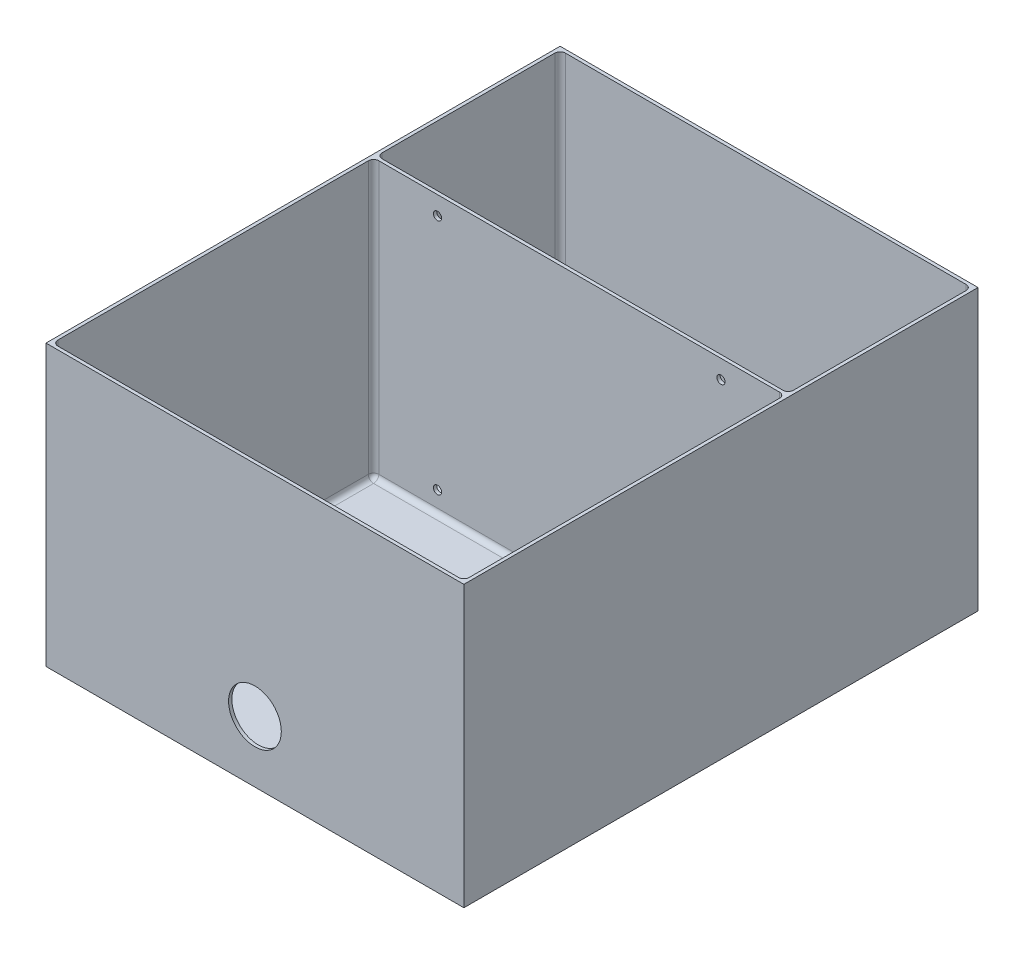
from build123d import *

# Parameters (mm, degrees)
SKETCH2_W           = 158.5
SKETCH2_H           = 195
BOSS_EXTRUDE1_DEPTH = 1.25
SKETCH1_W           = 156
SKETCH1_H           = 69.5
BOSS_EXTRUDE2_DEPTH = 105
SKETCH4_R           = 2.5
BOSS_EXTRUDE3_DEPTH = 8
FILLET2_R           = 2
SKETCH5_R           = 1.55
CUT_EXTRUDE1_DEPTH  = 8
SKETCH6_R           = 10
CUT_EXTRUDE2_DEPTH  = 8


with BuildPart() as part:
    # Sketch2 → Boss-Extrude1 (new body)
    with BuildSketch(Plane(origin=(0, 0, 0), x_dir=(1, 0, 0), z_dir=(0, 1, 0))):
        with Locations((0, -61.5)):
            Rectangle(SKETCH2_W, SKETCH2_H)
    extrude(amount=-BOSS_EXTRUDE1_DEPTH)

    # Sketch1 → Boss-Extrude2 (add)
    with BuildSketch(Plane(origin=(0, 0, 0), x_dir=(1, 0, 0), z_dir=(0, 1, 0))):
        Polygon((79.25, -159), (-79.25, -159), (-79.25, -86), (-79.25, -36), (-79.25, 36), (79.25, 36), (79.25, -36), (79.25, -86), align=None)
        Polygon((-78, -157.75), (78, -157.75), (78, -86), (78, -36), (-78, -36), (-78, -86), (-78, -100.588597569), align=None, mode=Mode.SUBTRACT)
        Rectangle(SKETCH1_W, SKETCH1_H, mode=Mode.SUBTRACT)
    extrude(amount=BOSS_EXTRUDE2_DEPTH)

    # Sketch4 → Boss-Extrude3 (add)
    with BuildSketch(Plane(origin=(0, 0, 0), x_dir=(1, 0, 0), z_dir=(0, 1, 0))):
        with Locations(Location((-37.075, -117.75, 0), (0, 0, 90))):
            Circle(SKETCH4_R)
        with Locations(Location((37.075, -117.75, 0), (0, 0, 90))):
            Circle(SKETCH4_R)
    extrude(amount=BOSS_EXTRUDE3_DEPTH)

    # Fillet2
    fillet2_edges = [part.edges().sort_by_distance(p)[0] for p in [
        (78, 52.5, -34.75),
        (78, 52.5, 34.75),
        (-78, 0, 0),
        (-78, 52.5, 34.75),
        (78, 52.5, 157.75),
        (-78, 52.5, 157.75),
        (0, 0, 36),
        (-78, 52.5, 36),
        (78, 0, 96.875),
        (78, 52.5, 36),
        (0, 0, -34.75),
        (-78, 52.5, -34.75),
        (0, 0, 157.75),
        (-78, 0, 96.875),
        (78, 0, 0),
        (0, 0, 34.75),
        (-37.075, 0, 120.25),
        (37.075, 0, 120.25),
    ]]
    fillet(fillet2_edges, radius=FILLET2_R)

    # Sketch5 → Cut-Extrude1 (cut)
    with BuildSketch(Plane.XY.offset(36)):
        with BuildLine():
            ThreePointArc((-53.75, 99.55), (-54.846015511, 99.096015511), (-55.3, 98))
            Line((-55.3, 98), (-53.75, 98))
            Line((-53.75, 98), (-53.75, 99.55))
        make_face()
        with BuildLine():
            Line((-53.75, 98), (-55.3, 98))
            ThreePointArc((-55.3, 98), (-53.75, 96.45), (-52.2, 98))
            ThreePointArc((-52.2, 98), (-52.653984489, 99.096015511), (-53.75, 99.55))
            Line((-53.75, 99.55), (-53.75, 98))
        make_face()
        with Locations((53.75, 98)):
            Circle(SKETCH5_R)
        with Locations((-53.75, 8)):
            Circle(SKETCH5_R)
        with Locations((53.75, 8)):
            Circle(SKETCH5_R)
    extrude(amount=-CUT_EXTRUDE1_DEPTH, mode=Mode.SUBTRACT)

    # Sketch6 → Cut-Extrude2 (cut)
    with BuildSketch(Plane(origin=(0, 0, 157.75), x_dir=(-1, 0, 0), z_dir=(0, 0, -1))):
        with Locations((0, 22)):
            Circle(SKETCH6_R)
    extrude(amount=-CUT_EXTRUDE2_DEPTH, mode=Mode.SUBTRACT)


solid = part.part
